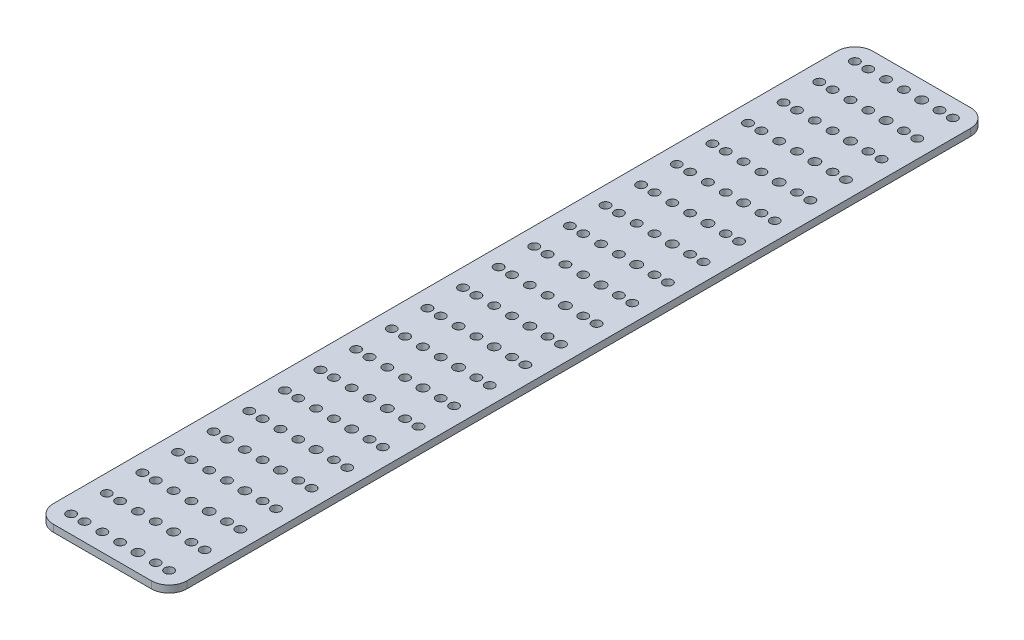
from build123d import *

# Parameters (mm, degrees)
SKETCH1_R           = 2.218759553
SKETCH1_R_2         = 2.05
BOSS_EXTRUDE1_DEPTH = 3.175


with BuildPart() as part:
    # Sketch1 → Boss-Extrude1 (new body)
    with BuildSketch(Plane.XZ):
        with BuildLine():
            Line((-22, -184), (22, -184))
            ThreePointArc((22, -184), (27.656854249, -181.656854249), (30, -176))
            Line((30, -176), (30, 176))
            ThreePointArc((30, 176), (27.656854249, 181.656854249), (22, 184))
            Line((22, 184), (-22, 184))
            ThreePointArc((-22, 184), (-27.656854249, 181.656854249), (-30, 176))
            Line((-30, 176), (-30, -176))
            ThreePointArc((-30, -176), (-27.656854249, -181.656854249), (-22, -184))
        make_face()
        with Locations(Location((8, 176, 0), (0, 0, 90))):
            Circle(SKETCH1_R, mode=Mode.SUBTRACT)
        with Locations(Location((-8, 176, 0), (0, 0, 90))):
            Circle(SKETCH1_R_2, mode=Mode.SUBTRACT)
        with Locations(Location((16, 176, 0), (0, 0, 90))):
            Circle(SKETCH1_R_2, mode=Mode.SUBTRACT)
        with Locations(Location((22, 176, 0), (0, 0, 90))):
            Circle(SKETCH1_R_2, mode=Mode.SUBTRACT)
        with Locations(Location((0, 176, 0), (0, 0, 90))):
            Circle(SKETCH1_R_2, mode=Mode.SUBTRACT)
        with Locations(Location((-16, 176, 0), (0, 0, 90))):
            Circle(SKETCH1_R_2, mode=Mode.SUBTRACT)
        with Locations(Location((-22, 176, 0), (0, 0, 90))):
            Circle(SKETCH1_R_2, mode=Mode.SUBTRACT)
        with Locations(Location((8, 160, 0), (0, 0, 90))):
            Circle(SKETCH1_R, mode=Mode.SUBTRACT)
        with Locations(Location((-8, 160, 0), (0, 0, 90))):
            Circle(SKETCH1_R_2, mode=Mode.SUBTRACT)
        with Locations(Location((16, 160, 0), (0, 0, 90))):
            Circle(SKETCH1_R_2, mode=Mode.SUBTRACT)
        with Locations(Location((22, 160, 0), (0, 0, 90))):
            Circle(SKETCH1_R_2, mode=Mode.SUBTRACT)
        with Locations(Location((0, 160, 0), (0, 0, 90))):
            Circle(SKETCH1_R_2, mode=Mode.SUBTRACT)
        with Locations(Location((-16, 160, 0), (0, 0, 90))):
            Circle(SKETCH1_R_2, mode=Mode.SUBTRACT)
        with Locations(Location((-22, 160, 0), (0, 0, 90))):
            Circle(SKETCH1_R_2, mode=Mode.SUBTRACT)
        with Locations(Location((8, 144, 0), (0, 0, 90))):
            Circle(SKETCH1_R, mode=Mode.SUBTRACT)
        with Locations(Location((-8, 144, 0), (0, 0, 90))):
            Circle(SKETCH1_R_2, mode=Mode.SUBTRACT)
        with Locations(Location((16, 144, 0), (0, 0, 90))):
            Circle(SKETCH1_R_2, mode=Mode.SUBTRACT)
        with Locations(Location((22, 144, 0), (0, 0, 90))):
            Circle(SKETCH1_R_2, mode=Mode.SUBTRACT)
        with Locations(Location((0, 144, 0), (0, 0, 90))):
            Circle(SKETCH1_R_2, mode=Mode.SUBTRACT)
        with Locations(Location((-16, 144, 0), (0, 0, 90))):
            Circle(SKETCH1_R_2, mode=Mode.SUBTRACT)
        with Locations(Location((-22, 144, 0), (0, 0, 90))):
            Circle(SKETCH1_R_2, mode=Mode.SUBTRACT)
        with Locations(Location((8, 128, 0), (0, 0, 90))):
            Circle(SKETCH1_R, mode=Mode.SUBTRACT)
        with Locations(Location((-8, 128, 0), (0, 0, 90))):
            Circle(SKETCH1_R_2, mode=Mode.SUBTRACT)
        with Locations(Location((16, 128, 0), (0, 0, 90))):
            Circle(SKETCH1_R_2, mode=Mode.SUBTRACT)
        with Locations(Location((22, 128, 0), (0, 0, 90))):
            Circle(SKETCH1_R_2, mode=Mode.SUBTRACT)
        with Locations(Location((0, 128, 0), (0, 0, 90))):
            Circle(SKETCH1_R_2, mode=Mode.SUBTRACT)
        with Locations(Location((-16, 128, 0), (0, 0, 90))):
            Circle(SKETCH1_R_2, mode=Mode.SUBTRACT)
        with Locations(Location((-22, 128, 0), (0, 0, 90))):
            Circle(SKETCH1_R_2, mode=Mode.SUBTRACT)
        with Locations(Location((8, 112, 0), (0, 0, 90))):
            Circle(SKETCH1_R, mode=Mode.SUBTRACT)
        with Locations(Location((-8, 112, 0), (0, 0, 90))):
            Circle(SKETCH1_R_2, mode=Mode.SUBTRACT)
        with Locations(Location((16, 112, 0), (0, 0, 90))):
            Circle(SKETCH1_R_2, mode=Mode.SUBTRACT)
        with Locations(Location((22, 112, 0), (0, 0, 90))):
            Circle(SKETCH1_R_2, mode=Mode.SUBTRACT)
        with Locations(Location((0, 112, 0), (0, 0, 90))):
            Circle(SKETCH1_R_2, mode=Mode.SUBTRACT)
        with Locations(Location((-16, 112, 0), (0, 0, 90))):
            Circle(SKETCH1_R_2, mode=Mode.SUBTRACT)
        with Locations(Location((-22, 112, 0), (0, 0, 90))):
            Circle(SKETCH1_R_2, mode=Mode.SUBTRACT)
        with Locations(Location((8, 96, 0), (0, 0, 90))):
            Circle(SKETCH1_R, mode=Mode.SUBTRACT)
        with Locations(Location((-8, 96, 0), (0, 0, 90))):
            Circle(SKETCH1_R_2, mode=Mode.SUBTRACT)
        with Locations(Location((16, 96, 0), (0, 0, 90))):
            Circle(SKETCH1_R_2, mode=Mode.SUBTRACT)
        with Locations(Location((22, 96, 0), (0, 0, 90))):
            Circle(SKETCH1_R_2, mode=Mode.SUBTRACT)
        with Locations(Location((0, 96, 0), (0, 0, 90))):
            Circle(SKETCH1_R_2, mode=Mode.SUBTRACT)
        with Locations(Location((-16, 96, 0), (0, 0, 90))):
            Circle(SKETCH1_R_2, mode=Mode.SUBTRACT)
        with Locations(Location((-22, 96, 0), (0, 0, 90))):
            Circle(SKETCH1_R_2, mode=Mode.SUBTRACT)
        with Locations(Location((8, 80, 0), (0, 0, 90))):
            Circle(SKETCH1_R, mode=Mode.SUBTRACT)
        with Locations(Location((-8, 80, 0), (0, 0, 90))):
            Circle(SKETCH1_R_2, mode=Mode.SUBTRACT)
        with Locations(Location((16, 80, 0), (0, 0, 90))):
            Circle(SKETCH1_R_2, mode=Mode.SUBTRACT)
        with Locations(Location((22, 80, 0), (0, 0, 90))):
            Circle(SKETCH1_R_2, mode=Mode.SUBTRACT)
        with Locations(Location((0, 80, 0), (0, 0, 90))):
            Circle(SKETCH1_R_2, mode=Mode.SUBTRACT)
        with Locations(Location((-16, 80, 0), (0, 0, 90))):
            Circle(SKETCH1_R_2, mode=Mode.SUBTRACT)
        with Locations(Location((-22, 80, 0), (0, 0, 90))):
            Circle(SKETCH1_R_2, mode=Mode.SUBTRACT)
        with Locations(Location((8, 64, 0), (0, 0, 90))):
            Circle(SKETCH1_R, mode=Mode.SUBTRACT)
        with Locations(Location((-8, 64, 0), (0, 0, 90))):
            Circle(SKETCH1_R_2, mode=Mode.SUBTRACT)
        with Locations(Location((16, 64, 0), (0, 0, 90))):
            Circle(SKETCH1_R_2, mode=Mode.SUBTRACT)
        with Locations(Location((22, 64, 0), (0, 0, 90))):
            Circle(SKETCH1_R_2, mode=Mode.SUBTRACT)
        with Locations(Location((0, 64, 0), (0, 0, 90))):
            Circle(SKETCH1_R_2, mode=Mode.SUBTRACT)
        with Locations(Location((-16, 64, 0), (0, 0, 90))):
            Circle(SKETCH1_R_2, mode=Mode.SUBTRACT)
        with Locations(Location((-22, 64, 0), (0, 0, 90))):
            Circle(SKETCH1_R_2, mode=Mode.SUBTRACT)
        with Locations(Location((8, 48, 0), (0, 0, 90))):
            Circle(SKETCH1_R, mode=Mode.SUBTRACT)
        with Locations(Location((-8, 48, 0), (0, 0, 90))):
            Circle(SKETCH1_R_2, mode=Mode.SUBTRACT)
        with Locations(Location((16, 48, 0), (0, 0, 90))):
            Circle(SKETCH1_R_2, mode=Mode.SUBTRACT)
        with Locations(Location((22, 48, 0), (0, 0, 90))):
            Circle(SKETCH1_R_2, mode=Mode.SUBTRACT)
        with Locations(Location((0, 48, 0), (0, 0, 90))):
            Circle(SKETCH1_R_2, mode=Mode.SUBTRACT)
        with Locations(Location((-16, 48, 0), (0, 0, 90))):
            Circle(SKETCH1_R_2, mode=Mode.SUBTRACT)
        with Locations(Location((-22, 48, 0), (0, 0, 90))):
            Circle(SKETCH1_R_2, mode=Mode.SUBTRACT)
        with Locations(Location((8, 32, 0), (0, 0, 90))):
            Circle(SKETCH1_R, mode=Mode.SUBTRACT)
        with Locations(Location((-8, 32, 0), (0, 0, 90))):
            Circle(SKETCH1_R_2, mode=Mode.SUBTRACT)
        with Locations(Location((16, 32, 0), (0, 0, 90))):
            Circle(SKETCH1_R_2, mode=Mode.SUBTRACT)
        with Locations(Location((22, 32, 0), (0, 0, 90))):
            Circle(SKETCH1_R_2, mode=Mode.SUBTRACT)
        with Locations(Location((0, 32, 0), (0, 0, 90))):
            Circle(SKETCH1_R_2, mode=Mode.SUBTRACT)
        with Locations(Location((-16, 32, 0), (0, 0, 90))):
            Circle(SKETCH1_R_2, mode=Mode.SUBTRACT)
        with Locations(Location((-22, 32, 0), (0, 0, 90))):
            Circle(SKETCH1_R_2, mode=Mode.SUBTRACT)
        with Locations(Location((8, 16, 0), (0, 0, 90))):
            Circle(SKETCH1_R, mode=Mode.SUBTRACT)
        with Locations(Location((-8, 16, 0), (0, 0, 90))):
            Circle(SKETCH1_R_2, mode=Mode.SUBTRACT)
        with Locations(Location((16, 16, 0), (0, 0, 90))):
            Circle(SKETCH1_R_2, mode=Mode.SUBTRACT)
        with Locations(Location((22, 16, 0), (0, 0, 90))):
            Circle(SKETCH1_R_2, mode=Mode.SUBTRACT)
        with Locations(Location((0, 16, 0), (0, 0, 90))):
            Circle(SKETCH1_R_2, mode=Mode.SUBTRACT)
        with Locations(Location((-16, 16, 0), (0, 0, 90))):
            Circle(SKETCH1_R_2, mode=Mode.SUBTRACT)
        with Locations(Location((-22, 16, 0), (0, 0, 90))):
            Circle(SKETCH1_R_2, mode=Mode.SUBTRACT)
        with Locations(Location((8, 0, 0), (0, 0, 90))):
            Circle(SKETCH1_R, mode=Mode.SUBTRACT)
        with Locations(Location((-8, 0, 0), (0, 0, 90))):
            Circle(SKETCH1_R_2, mode=Mode.SUBTRACT)
        with Locations(Location((16, 0, 0), (0, 0, 90))):
            Circle(SKETCH1_R_2, mode=Mode.SUBTRACT)
        with Locations(Location((22, 0, 0), (0, 0, 90))):
            Circle(SKETCH1_R_2, mode=Mode.SUBTRACT)
        with Locations(Location((0, 0, 0), (0, 0, 90))):
            Circle(SKETCH1_R_2, mode=Mode.SUBTRACT)
        with Locations(Location((-16, 0, 0), (0, 0, 90))):
            Circle(SKETCH1_R_2, mode=Mode.SUBTRACT)
        with Locations(Location((-22, 0, 0), (0, 0, 90))):
            Circle(SKETCH1_R_2, mode=Mode.SUBTRACT)
        with Locations(Location((8, -16, 0), (0, 0, 90))):
            Circle(SKETCH1_R, mode=Mode.SUBTRACT)
        with Locations(Location((-8, -16, 0), (0, 0, 90))):
            Circle(SKETCH1_R_2, mode=Mode.SUBTRACT)
        with Locations(Location((16, -16, 0), (0, 0, 90))):
            Circle(SKETCH1_R_2, mode=Mode.SUBTRACT)
        with Locations(Location((22, -16, 0), (0, 0, 90))):
            Circle(SKETCH1_R_2, mode=Mode.SUBTRACT)
        with Locations(Location((0, -16, 0), (0, 0, 90))):
            Circle(SKETCH1_R_2, mode=Mode.SUBTRACT)
        with Locations(Location((-16, -16, 0), (0, 0, 90))):
            Circle(SKETCH1_R_2, mode=Mode.SUBTRACT)
        with Locations(Location((-22, -16, 0), (0, 0, 90))):
            Circle(SKETCH1_R_2, mode=Mode.SUBTRACT)
        with Locations(Location((8, -32, 0), (0, 0, 90))):
            Circle(SKETCH1_R, mode=Mode.SUBTRACT)
        with Locations(Location((-8, -32, 0), (0, 0, 90))):
            Circle(SKETCH1_R_2, mode=Mode.SUBTRACT)
        with Locations(Location((16, -32, 0), (0, 0, 90))):
            Circle(SKETCH1_R_2, mode=Mode.SUBTRACT)
        with Locations(Location((22, -32, 0), (0, 0, 90))):
            Circle(SKETCH1_R_2, mode=Mode.SUBTRACT)
        with Locations(Location((0, -32, 0), (0, 0, 90))):
            Circle(SKETCH1_R_2, mode=Mode.SUBTRACT)
        with Locations(Location((-16, -32, 0), (0, 0, 90))):
            Circle(SKETCH1_R_2, mode=Mode.SUBTRACT)
        with Locations(Location((-22, -32, 0), (0, 0, 90))):
            Circle(SKETCH1_R_2, mode=Mode.SUBTRACT)
        with Locations(Location((8, -48, 0), (0, 0, 90))):
            Circle(SKETCH1_R, mode=Mode.SUBTRACT)
        with Locations(Location((-8, -48, 0), (0, 0, 90))):
            Circle(SKETCH1_R_2, mode=Mode.SUBTRACT)
        with Locations(Location((16, -48, 0), (0, 0, 90))):
            Circle(SKETCH1_R_2, mode=Mode.SUBTRACT)
        with Locations(Location((22, -48, 0), (0, 0, 90))):
            Circle(SKETCH1_R_2, mode=Mode.SUBTRACT)
        with Locations(Location((0, -48, 0), (0, 0, 90))):
            Circle(SKETCH1_R_2, mode=Mode.SUBTRACT)
        with Locations(Location((-16, -48, 0), (0, 0, 90))):
            Circle(SKETCH1_R_2, mode=Mode.SUBTRACT)
        with Locations(Location((-22, -48, 0), (0, 0, 90))):
            Circle(SKETCH1_R_2, mode=Mode.SUBTRACT)
        with Locations(Location((8, -64, 0), (0, 0, 90))):
            Circle(SKETCH1_R, mode=Mode.SUBTRACT)
        with Locations(Location((-8, -64, 0), (0, 0, 90))):
            Circle(SKETCH1_R_2, mode=Mode.SUBTRACT)
        with Locations(Location((16, -64, 0), (0, 0, 90))):
            Circle(SKETCH1_R_2, mode=Mode.SUBTRACT)
        with Locations(Location((22, -64, 0), (0, 0, 90))):
            Circle(SKETCH1_R_2, mode=Mode.SUBTRACT)
        with Locations(Location((0, -64, 0), (0, 0, 90))):
            Circle(SKETCH1_R_2, mode=Mode.SUBTRACT)
        with Locations(Location((-16, -64, 0), (0, 0, 90))):
            Circle(SKETCH1_R_2, mode=Mode.SUBTRACT)
        with Locations(Location((-22, -64, 0), (0, 0, 90))):
            Circle(SKETCH1_R_2, mode=Mode.SUBTRACT)
        with Locations(Location((8, -80, 0), (0, 0, 90))):
            Circle(SKETCH1_R, mode=Mode.SUBTRACT)
        with Locations(Location((-8, -80, 0), (0, 0, 90))):
            Circle(SKETCH1_R_2, mode=Mode.SUBTRACT)
        with Locations(Location((16, -80, 0), (0, 0, 90))):
            Circle(SKETCH1_R_2, mode=Mode.SUBTRACT)
        with Locations(Location((22, -80, 0), (0, 0, 90))):
            Circle(SKETCH1_R_2, mode=Mode.SUBTRACT)
        with Locations(Location((0, -80, 0), (0, 0, 90))):
            Circle(SKETCH1_R_2, mode=Mode.SUBTRACT)
        with Locations(Location((-16, -80, 0), (0, 0, 90))):
            Circle(SKETCH1_R_2, mode=Mode.SUBTRACT)
        with Locations(Location((-22, -80, 0), (0, 0, 90))):
            Circle(SKETCH1_R_2, mode=Mode.SUBTRACT)
        with Locations(Location((8, -96, 0), (0, 0, 90))):
            Circle(SKETCH1_R, mode=Mode.SUBTRACT)
        with Locations(Location((-8, -96, 0), (0, 0, 90))):
            Circle(SKETCH1_R_2, mode=Mode.SUBTRACT)
        with Locations(Location((16, -96, 0), (0, 0, 90))):
            Circle(SKETCH1_R_2, mode=Mode.SUBTRACT)
        with Locations(Location((22, -96, 0), (0, 0, 90))):
            Circle(SKETCH1_R_2, mode=Mode.SUBTRACT)
        with Locations(Location((0, -96, 0), (0, 0, 90))):
            Circle(SKETCH1_R_2, mode=Mode.SUBTRACT)
        with Locations(Location((-16, -96, 0), (0, 0, 90))):
            Circle(SKETCH1_R_2, mode=Mode.SUBTRACT)
        with Locations(Location((-22, -96, 0), (0, 0, 90))):
            Circle(SKETCH1_R_2, mode=Mode.SUBTRACT)
        with Locations(Location((8, -112, 0), (0, 0, 90))):
            Circle(SKETCH1_R, mode=Mode.SUBTRACT)
        with Locations(Location((-8, -112, 0), (0, 0, 90))):
            Circle(SKETCH1_R_2, mode=Mode.SUBTRACT)
        with Locations(Location((16, -112, 0), (0, 0, 90))):
            Circle(SKETCH1_R_2, mode=Mode.SUBTRACT)
        with Locations(Location((22, -112, 0), (0, 0, 90))):
            Circle(SKETCH1_R_2, mode=Mode.SUBTRACT)
        with Locations(Location((0, -112, 0), (0, 0, 90))):
            Circle(SKETCH1_R_2, mode=Mode.SUBTRACT)
        with Locations(Location((-16, -112, 0), (0, 0, 90))):
            Circle(SKETCH1_R_2, mode=Mode.SUBTRACT)
        with Locations(Location((-22, -112, 0), (0, 0, 90))):
            Circle(SKETCH1_R_2, mode=Mode.SUBTRACT)
        with Locations(Location((8, -128, 0), (0, 0, 90))):
            Circle(SKETCH1_R, mode=Mode.SUBTRACT)
        with Locations(Location((-8, -128, 0), (0, 0, 90))):
            Circle(SKETCH1_R_2, mode=Mode.SUBTRACT)
        with Locations(Location((16, -128, 0), (0, 0, 90))):
            Circle(SKETCH1_R_2, mode=Mode.SUBTRACT)
        with Locations(Location((22, -128, 0), (0, 0, 90))):
            Circle(SKETCH1_R_2, mode=Mode.SUBTRACT)
        with Locations(Location((0, -128, 0), (0, 0, 90))):
            Circle(SKETCH1_R_2, mode=Mode.SUBTRACT)
        with Locations(Location((-16, -128, 0), (0, 0, 90))):
            Circle(SKETCH1_R_2, mode=Mode.SUBTRACT)
        with Locations(Location((-22, -128, 0), (0, 0, 90))):
            Circle(SKETCH1_R_2, mode=Mode.SUBTRACT)
        with Locations(Location((8, -144, 0), (0, 0, 90))):
            Circle(SKETCH1_R, mode=Mode.SUBTRACT)
        with Locations(Location((-8, -144, 0), (0, 0, 90))):
            Circle(SKETCH1_R_2, mode=Mode.SUBTRACT)
        with Locations(Location((16, -144, 0), (0, 0, 90))):
            Circle(SKETCH1_R_2, mode=Mode.SUBTRACT)
        with Locations(Location((22, -144, 0), (0, 0, 90))):
            Circle(SKETCH1_R_2, mode=Mode.SUBTRACT)
        with Locations(Location((0, -144, 0), (0, 0, 90))):
            Circle(SKETCH1_R_2, mode=Mode.SUBTRACT)
        with Locations(Location((-16, -144, 0), (0, 0, 90))):
            Circle(SKETCH1_R_2, mode=Mode.SUBTRACT)
        with Locations(Location((-22, -144, 0), (0, 0, 90))):
            Circle(SKETCH1_R_2, mode=Mode.SUBTRACT)
        with Locations(Location((8, -160, 0), (0, 0, 90))):
            Circle(SKETCH1_R, mode=Mode.SUBTRACT)
        with Locations(Location((-8, -160, 0), (0, 0, 90))):
            Circle(SKETCH1_R_2, mode=Mode.SUBTRACT)
        with Locations(Location((16, -160, 0), (0, 0, 90))):
            Circle(SKETCH1_R_2, mode=Mode.SUBTRACT)
        with Locations(Location((22, -160, 0), (0, 0, 90))):
            Circle(SKETCH1_R_2, mode=Mode.SUBTRACT)
        with Locations(Location((0, -160, 0), (0, 0, 90))):
            Circle(SKETCH1_R_2, mode=Mode.SUBTRACT)
        with Locations(Location((-16, -160, 0), (0, 0, 90))):
            Circle(SKETCH1_R_2, mode=Mode.SUBTRACT)
        with Locations(Location((-22, -160, 0), (0, 0, 90))):
            Circle(SKETCH1_R_2, mode=Mode.SUBTRACT)
        with Locations(Location((8, -176, 0), (0, 0, 90))):
            Circle(SKETCH1_R, mode=Mode.SUBTRACT)
        with Locations(Location((-8, -176, 0), (0, 0, 90))):
            Circle(SKETCH1_R_2, mode=Mode.SUBTRACT)
        with Locations(Location((16, -176, 0), (0, 0, 90))):
            Circle(SKETCH1_R_2, mode=Mode.SUBTRACT)
        with Locations(Location((22, -176, 0), (0, 0, 90))):
            Circle(SKETCH1_R_2, mode=Mode.SUBTRACT)
        with Locations(Location((0, -176, 0), (0, 0, 90))):
            Circle(SKETCH1_R_2, mode=Mode.SUBTRACT)
        with Locations(Location((-16, -176, 0), (0, 0, 90))):
            Circle(SKETCH1_R_2, mode=Mode.SUBTRACT)
        with Locations(Location((-22, -176, 0), (0, 0, 90))):
            Circle(SKETCH1_R_2, mode=Mode.SUBTRACT)
    extrude(amount=-BOSS_EXTRUDE1_DEPTH)


solid = part.part
